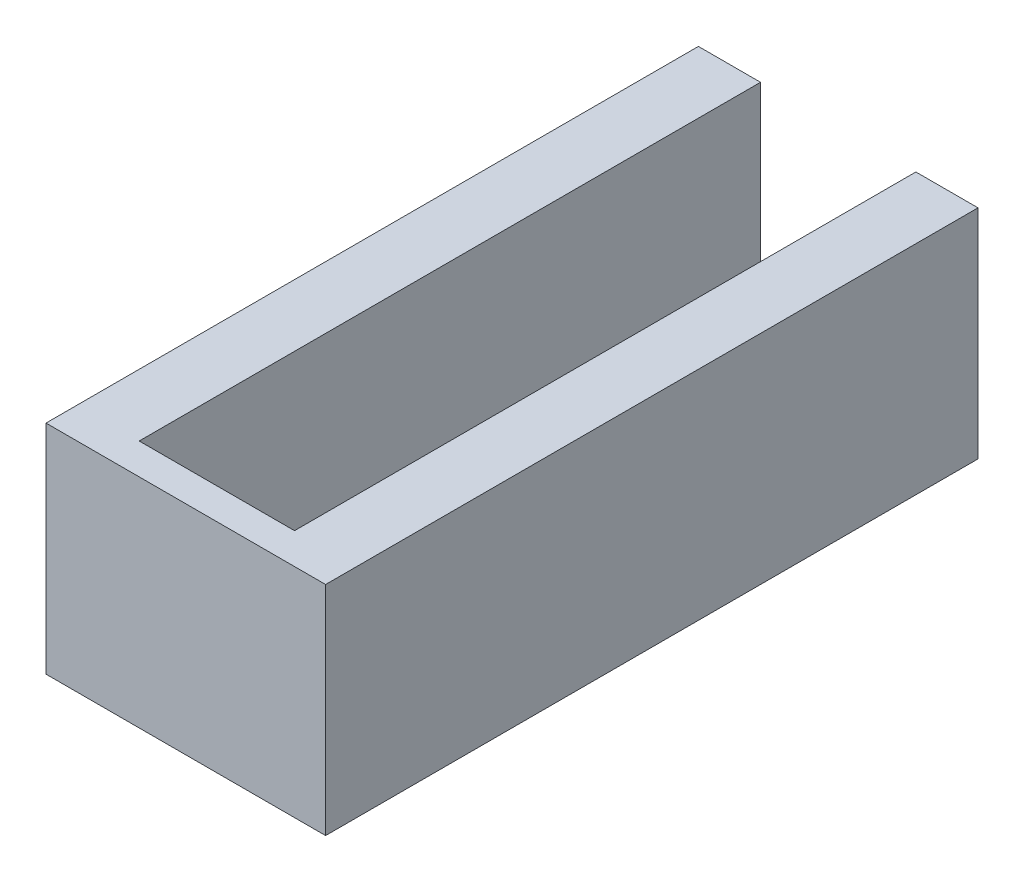
from build123d import *

# Parameters (mm, degrees)
BOSS_EXTRUDE1_DEPTH = 20
SKETCH3_W           = 9
SKETCH3_H           = 7
BOSS_EXTRUDE2_DEPTH = 1


with BuildPart() as part:
    # Sketch1 → Boss-Extrude1 (new body)
    with BuildSketch(Plane.XY):
        Polygon((0, 0), (0, -7), (-9, -7), (-9, 0), (-7, 0), (-7, -5), (-2, -5), (-2, 0), align=None)
    extrude(amount=BOSS_EXTRUDE1_DEPTH)

    # Sketch3 → Boss-Extrude2 (add)
    with BuildSketch(Plane.XY.offset(20)):
        with Locations((-4.5, -3.5)):
            Rectangle(SKETCH3_W, SKETCH3_H)
    extrude(amount=BOSS_EXTRUDE2_DEPTH)


solid = part.part
